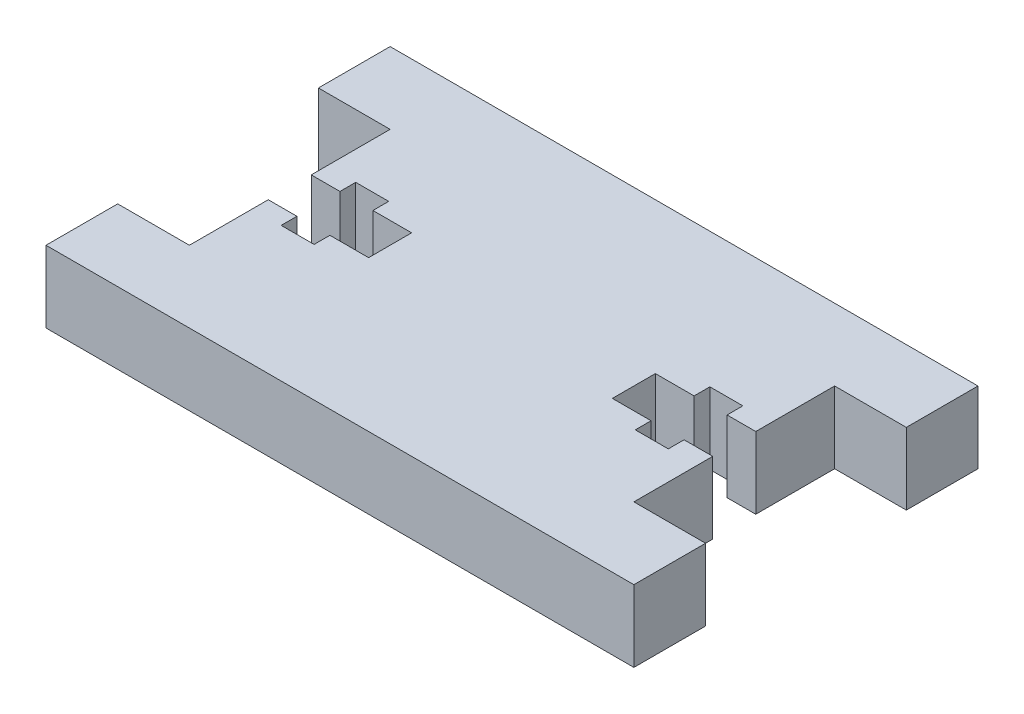
from build123d import *

# Parameters (mm, degrees)
BOSS_EXTRUDE1_DEPTH = 5


with BuildPart() as part:
    # Sketch1 → Boss-Extrude1 (new body)
    with BuildSketch(Plane(origin=(0, 0, 0), x_dir=(1, 0, 0), z_dir=(0, 1, 0))):
        Polygon((44.375484097, 7.788988346), (75.375484097, 7.788988346), (80.375484097, 7.788988346), (80.375484097, 12.788988346), (75.375484097, 12.788988346), (75.375484097, 18.288988346), (73.375484097, 18.288988346), (73.375484097, 17.188988346), (71.075484097, 17.188988346), (71.075484097, 18.288988346), (68.375484097, 18.288988346), (68.375484097, 21.288988346), (71.075484097, 21.288988346), (71.075484097, 22.388988346), (73.375484097, 22.388988346), (73.375484097, 21.288988346), (75.375484097, 21.288988346), (75.375484097, 26.788988346), (80.375484097, 26.788988346), (80.375484097, 31.788988346), (75.375484097, 31.788988346), (44.375484097, 31.788988346), (39.375484097, 31.788988346), (39.375484097, 26.788988346), (44.375484097, 26.788988346), (44.375484097, 21.288988346), (46.375484097, 21.288988346), (46.375484097, 22.388988346), (48.675484097, 22.388988346), (48.675484097, 21.288988346), (51.375484097, 21.288988346), (51.375484097, 18.288988346), (48.675484097, 18.288988346), (48.675484097, 17.188988346), (46.375484097, 17.188988346), (46.375484097, 18.288988346), (44.375484097, 18.288988346), (44.375484097, 12.788988346), (39.375484097, 12.788988346), (39.375484097, 7.788988346), align=None)
    extrude(amount=BOSS_EXTRUDE1_DEPTH)


solid = part.part
